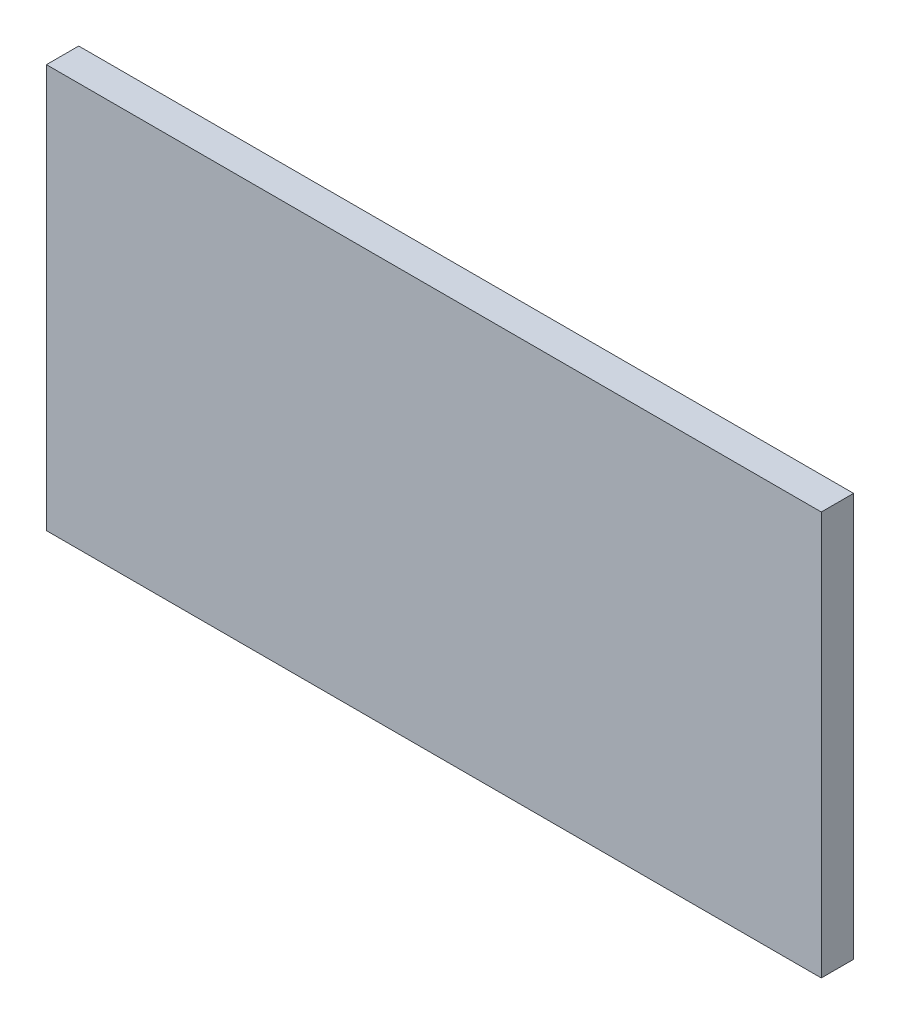
from build123d import *

# Parameters (mm, degrees)
SKETCH2_W           = 1219.2
SKETCH2_H           = 635
BOSS_EXTRUDE1_DEPTH = 50.8


with BuildPart() as part:
    # Sketch2 → Boss-Extrude1 (new body)
    with BuildSketch(Plane(origin=(-46.908497129, 0, 0), x_dir=(1, 0, 0), z_dir=(0, 0, 1))):
        with Locations((844.402811715, 680.178539437)):
            Rectangle(SKETCH2_W, SKETCH2_H)
    extrude(amount=-BOSS_EXTRUDE1_DEPTH)


solid = part.part
